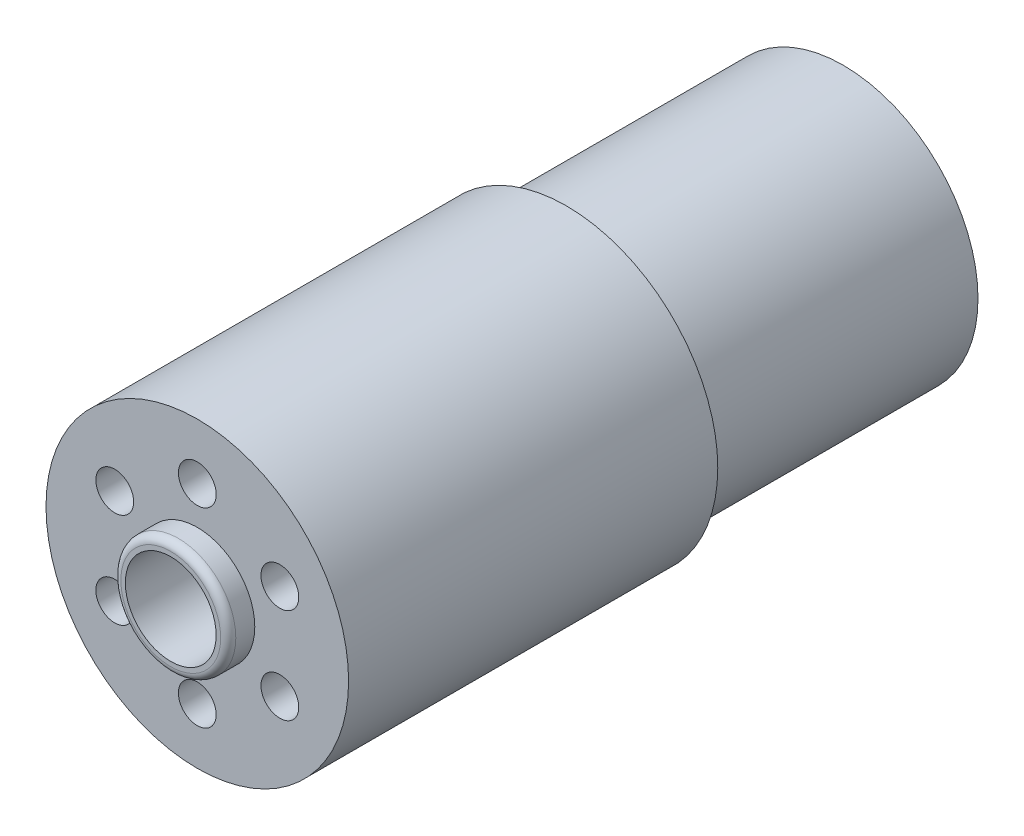
from build123d import *

# Parameters (mm, degrees)
SKETCH1_R           = 25.4
BOSS_EXTRUDE2_DEPTH = 108.458
SKETCH6_R           = 7.62
SKETCH6_R_2         = 3.175
CUT_EXTRUDE1_DEPTH  = 108.458
SKETCH7_R           = 25.4
SKETCH7_R_2         = 22.606
CUT_EXTRUDE2_DEPTH  = 46.482
SKETCH8_R           = 9.652
SKETCH8_R_2         = 7.62
BOSS_EXTRUDE7_DEPTH = 4.4577
BOSS_EXTRUDE8_START = 4.4577
SKETCH9_R           = 9.652
SKETCH9_R_2         = 7.62
BOSS_EXTRUDE8_DEPTH = 4.4577
FILLET1_R           = 1.27


with BuildPart() as part:
    # Sketch1 → Boss-Extrude2 (new body)
    with BuildSketch(Plane.XY):
        Circle(SKETCH1_R)
    extrude(amount=BOSS_EXTRUDE2_DEPTH)

    # Sketch6 → Cut-Extrude1 (cut)
    with BuildSketch(Plane(origin=(0, 0, 0), x_dir=(-1, 0, 0), z_dir=(0, 0, -1))):
        Circle(SKETCH6_R)
        with Locations((-13.858138511, 8.001)):
            Circle(SKETCH6_R_2)
        with Locations((0, 16.002)):
            Circle(SKETCH6_R_2)
        with Locations((13.858138511, 8.001)):
            Circle(SKETCH6_R_2)
        with Locations((13.858138511, -8.001)):
            Circle(SKETCH6_R_2)
        with Locations((0, -16.002)):
            Circle(SKETCH6_R_2)
        with Locations((-13.858138511, -8.001)):
            Circle(SKETCH6_R_2)
    extrude(amount=-CUT_EXTRUDE1_DEPTH, mode=Mode.SUBTRACT)

    # Sketch7 → Cut-Extrude2 (cut)
    with BuildSketch(Plane(origin=(0, 0, 0), x_dir=(-1, 0, 0), z_dir=(0, 0, -1))):
        Circle(SKETCH7_R)
        Circle(SKETCH7_R_2, mode=Mode.SUBTRACT)
    extrude(amount=-CUT_EXTRUDE2_DEPTH, mode=Mode.SUBTRACT)

    # Sketch8 → Boss-Extrude7 (add)
    with BuildSketch(Plane.XY.offset(108.458)):
        Circle(SKETCH8_R)
        with Locations(Location((0, 0, 0), (0, 0, 180))):
            Circle(SKETCH8_R_2, mode=Mode.SUBTRACT)
    extrude(amount=BOSS_EXTRUDE7_DEPTH)

    # Sketch9 → Boss-Extrude8 (add)
    with BuildSketch(Plane(origin=(0, 0, 0), x_dir=(-1, 0, 0), z_dir=(0, 0, -1)).offset(BOSS_EXTRUDE8_START)):
        with Locations(Location((0, 0, 0), (0, 0, 180))):
            Circle(SKETCH9_R)
        Circle(SKETCH9_R_2, mode=Mode.SUBTRACT)
    extrude(amount=-BOSS_EXTRUDE8_DEPTH)

    # Fillet1
    fillet1_edges = [part.edges().sort_by_distance(p)[0] for p in [
        (-9.652, 0, 112.9157),
        (-9.652, 0, -4.4577),
    ]]
    fillet(fillet1_edges, radius=FILLET1_R)


solid = part.part
